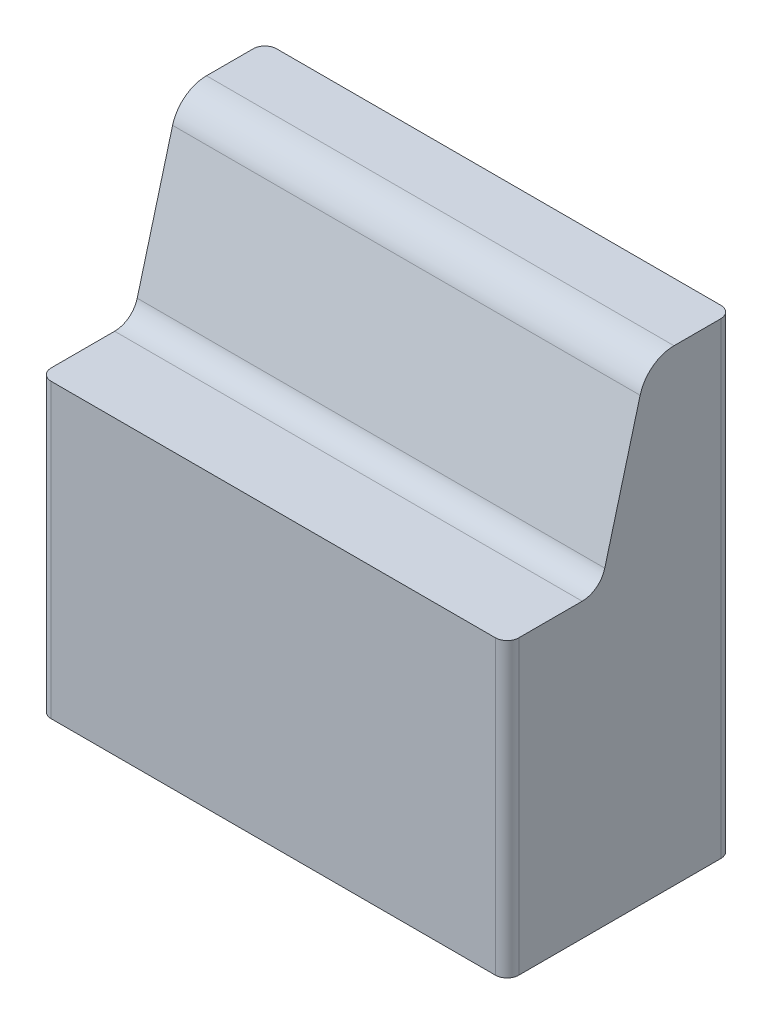
from build123d import *

# Parameters (mm, degrees)
BOSS_EXTRUDE1_DEPTH         = 20
FILLET1_R                   = 1
M6_TAPPED_HOLE1_D           = 5
M6_TAPPED_HOLE1_DEPTH       = 17
M6_TAPPED_HOLE1_CSINK_D     = 6.05
M6_TAPPED_HOLE1_CSINK_ANGLE = 90
M6_TAPPED_HOLE1_TIP         = 1.502151548
FILLET2_R                   = 2


with BuildPart() as part:
    # Sketch1 → Boss-Extrude1 (new, symmetric)
    with BuildSketch(Plane(origin=(0, 0, 0), x_dir=(0, 0, -1), z_dir=(1, 0, 0))):
        with BuildLine():
            Line((-5, 0), (0, 0))
            Line((0, 0), (0, -40))
            Line((0, -40), (-19.28, -40))
            Line((-19.28, -40), (-19.28, -15))
            Line((-19.28, -15), (-11.32121885, -15))
            Line((-11.32121885, -15), (-7.897777479, -2.223542865))
            ThreePointArc((-7.897777479, -2.223542865), (-6.826284287, -0.619939979), (-5, 0))
        make_face()
    extrude(amount=BOSS_EXTRUDE1_DEPTH, both=True)

    # Fillet1
    fillet1_edges = [part.edges().sort_by_distance(p)[0] for p in [
        (20, -27.5, 19.28),
        (20, -20, 0),
        (-20, -20, 0),
        (-20, -27.5, 19.28),
    ]]
    fillet(fillet1_edges, radius=FILLET1_R)

    # M6 Tapped Hole1
    with Locations(Plane(origin=(0, -40, 0), x_dir=(-1, 0, 0), z_dir=(0, -1, 0))):
        with Locations((-12.5, -7.5), (12.5, -7.5)):
            CounterSinkHole(M6_TAPPED_HOLE1_D / 2, M6_TAPPED_HOLE1_CSINK_D / 2, depth=M6_TAPPED_HOLE1_DEPTH, counter_sink_angle=M6_TAPPED_HOLE1_CSINK_ANGLE)
            with Locations((0, 0, -(M6_TAPPED_HOLE1_DEPTH + M6_TAPPED_HOLE1_TIP / 2))):  # 118° drill point
                Cone(0, M6_TAPPED_HOLE1_D / 2, M6_TAPPED_HOLE1_TIP, mode=Mode.SUBTRACT)

    # Fillet2
    fillet2_edges = [part.edges().sort_by_distance(p)[0] for p in [
        (0, -15, 11.32121885),
    ]]
    fillet(fillet2_edges, radius=FILLET2_R)


solid = part.part
